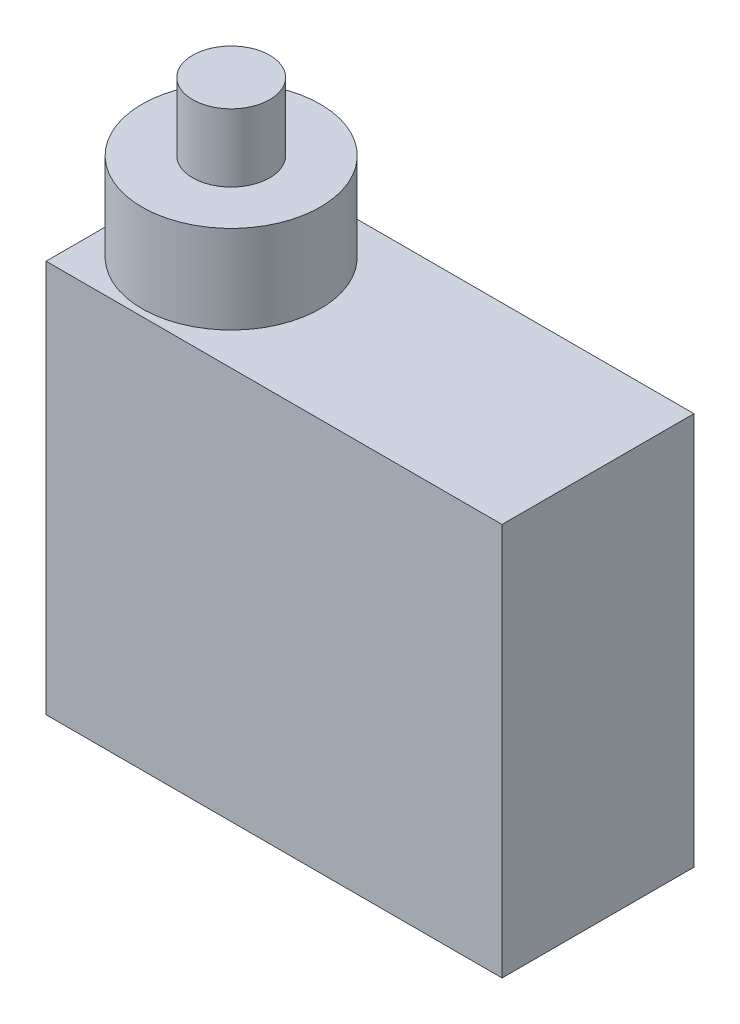
from build123d import *

# Parameters (mm, degrees)
SKETCH1_W           = 20.2
SKETCH1_H           = 17.4
BOSS_EXTRUDE1_DEPTH = 8.5
SKETCH2_R           = 3.95
BOSS_EXTRUDE2_DEPTH = 3.9
SKETCH3_R           = 1.7065
BOSS_EXTRUDE3_DEPTH = 3


with BuildPart() as part:
    # Sketch1 → Boss-Extrude1 (new body)
    with BuildSketch(Plane.XY):
        Rectangle(SKETCH1_W, SKETCH1_H)
    extrude(amount=BOSS_EXTRUDE1_DEPTH)

    # Sketch2 → Boss-Extrude2 (add)
    with BuildSketch(Plane(origin=(0, 8.7, 0), x_dir=(1, 0, 0), z_dir=(0, 1, 0))):
        with Locations(Location((-6.15, -4.25, 0), (0, 0, 180))):
            Circle(SKETCH2_R)
    extrude(amount=BOSS_EXTRUDE2_DEPTH)

    # Sketch3 → Boss-Extrude3 (add)
    with BuildSketch(Plane(origin=(0, 12.6, 0), x_dir=(1, 0, 0), z_dir=(0, 1, 0))):
        with Locations(Location((-6.15, -4.25, 0), (0, 0, 180))):
            Circle(SKETCH3_R)
    extrude(amount=BOSS_EXTRUDE3_DEPTH)


solid = part.part
